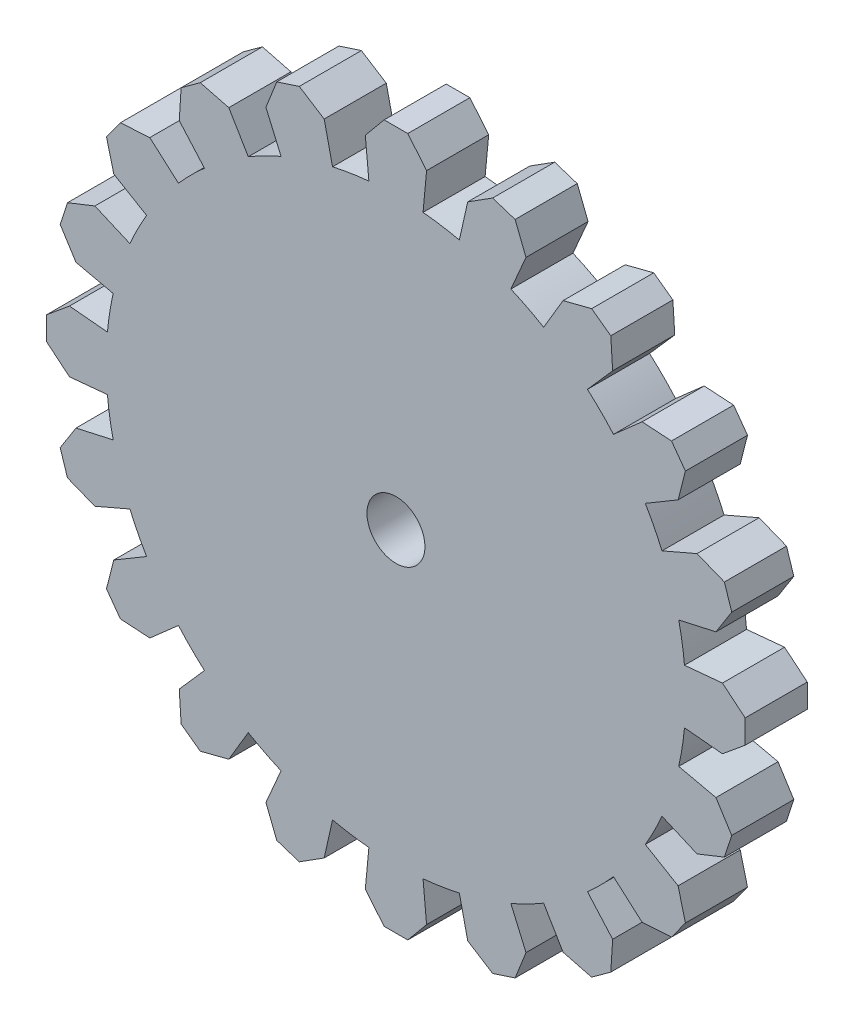
from build123d import *

# Parameters (mm, degrees)
SKETCH1_R               = 70
BOSS_EXTRUDE1_DEPTH     = 15
CUT_EXTRUDE5_DEPTH      = 55
CUT_EXTRUDE5_DEPTH_BACK = 101.124921973
SKETCH2_R               = 7
BOSS_EXTRUDE2_DEPTH     = 15
CIRPATTERN2_COUNT       = 20


with BuildPart() as part:
    # Sketch1 → Boss-Extrude1 (new body)
    with BuildSketch(Plane.XY):
        with Locations(Location((0, 0, 0), (0, 0, 180))):
            Circle(SKETCH1_R)
    extrude(amount=BOSS_EXTRUDE1_DEPTH)

    # Sketch2 → Cut-Extrude5 (cut, two sides: drawn at the far end of the back side and taken through both)
    with BuildSketch(Plane.XY.offset(-CUT_EXTRUDE5_DEPTH_BACK)):
        with Locations(Location((0, 0, 0), (0, 0, 180))):
            Circle(SKETCH2_R)
    extrude(amount=CUT_EXTRUDE5_DEPTH + CUT_EXTRUDE5_DEPTH_BACK, mode=Mode.SUBTRACT)

    # Sketch5 → Boss-Extrude2 (add)
    with BuildSketch(Plane.XY):
        Polygon((-6.539966856, 69.693822061), (-7.40050252, 78.864207898), (-2.856692059, 84.349096927), (2.856692059, 84.349096927), (7.40050252, 78.864207898), (6.539966856, 69.693822061), (6.538233044, 69.675345525), (-1.985773494, 69.971827928), (-6.526217216, 69.574369749), align=None)
    boss_extrude2 = extrude(amount=BOSS_EXTRUDE2_DEPTH)

    # CirPattern2: Boss-Extrude2 ×20 about axis
    cirpattern2_axis = Axis((0, 0, 0), (0, 0, 1))
    for i in range(1, CIRPATTERN2_COUNT):
        add(boss_extrude2.rotate(cirpattern2_axis, i * 360 / CIRPATTERN2_COUNT))


solid = part.part
